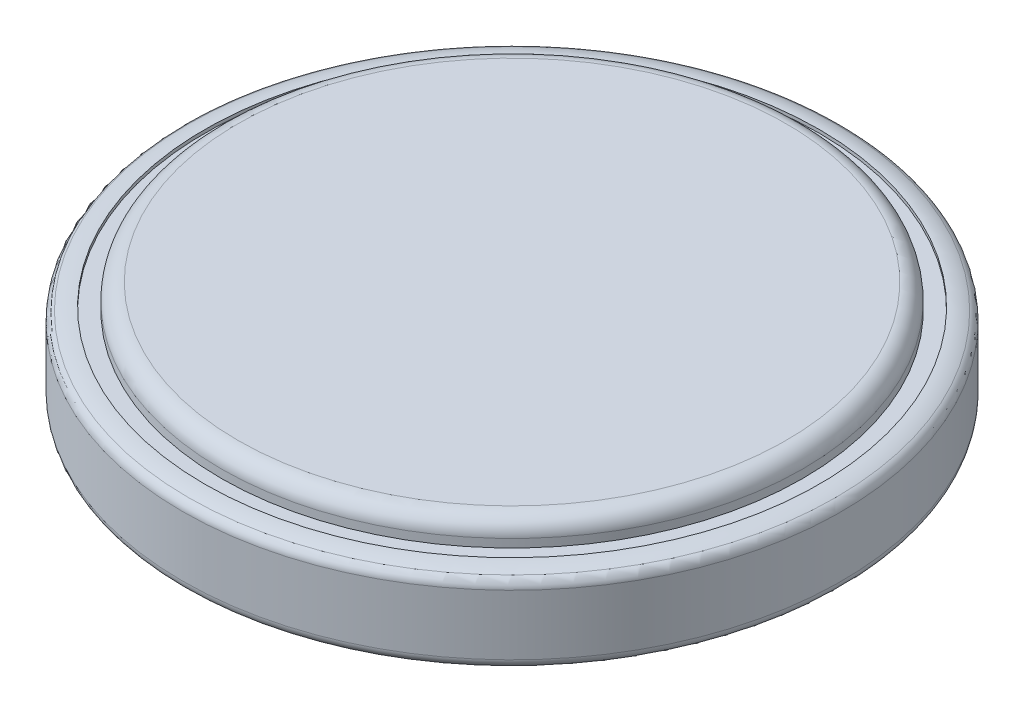
from build123d import *

# Parameters (mm, degrees)
SKETCH1_R           = 9.975
BOSS_EXTRUDE1_DEPTH = 3.15
FILLET1_R           = 0.5
CUT_EXTRUDE1_START  = -0.1
SKETCH3_R           = 9.3
SKETCH3_R_2         = 8.8
CUT_EXTRUDE1_DEPTH  = 0.1
FILLET2_R           = 0.3


with BuildPart() as part:
    # Sketch1 → Boss-Extrude1 (new body)
    with BuildSketch(Plane(origin=(0, 0, 0), x_dir=(1, 0, 0), z_dir=(0, 1, 0))):
        with Locations(Location((0, 0, 0), (0, 0, 270))):
            Circle(SKETCH1_R)
    extrude(amount=BOSS_EXTRUDE1_DEPTH)

    # Sketch2 → Cut-Revolve1 (revolve, cut)
    with BuildSketch(Plane.XY, mode=Mode.PRIVATE) as cut_revolve1_sk:
        with BuildLine():
            Line((8.8, 3.15), (8.8, 2.5))
            Line((8.8, 2.5), (9.3, 2.5))
            ThreePointArc((9.3, 2.5), (9.652003196, 2.448948287), (9.975, 2.3))
            Line((9.975, 2.3), (9.975, 3.15))
            Line((9.975, 3.15), (8.8, 3.15))
        make_face()
    revolve(cut_revolve1_sk.sketch.rotate(Axis((0, 0, 0), (0, 1, 0)), 90), axis=Axis((0, 0, 0), (0, 1, 0)), mode=Mode.SUBTRACT)

    # Fillet1
    fillet1_edges = [part.edges().sort_by_distance(p)[0] for p in [
        (0, 3.15, 8.8),
    ]]
    fillet(fillet1_edges, radius=FILLET1_R)

    # Sketch3 → Cut-Extrude1 (cut)
    with BuildSketch(Plane(origin=(0, 2.5, 0), x_dir=(1, 0, 0), z_dir=(0, 1, 0)).offset(CUT_EXTRUDE1_START)):
        with Locations(Location((0, 0, 0), (0, 0, 270))):
            Circle(SKETCH3_R)
        with Locations(Location((0, 0, 0), (0, 0, 270))):
            Circle(SKETCH3_R_2, mode=Mode.SUBTRACT)
    extrude(amount=CUT_EXTRUDE1_DEPTH, mode=Mode.SUBTRACT)

    # Fillet2
    fillet2_edges = [part.edges().sort_by_distance(p)[0] for p in [
        (0, 0, -9.975),
        (-9.975, 2.3, 0),
    ]]
    fillet(fillet2_edges, radius=FILLET2_R)


solid = part.part
